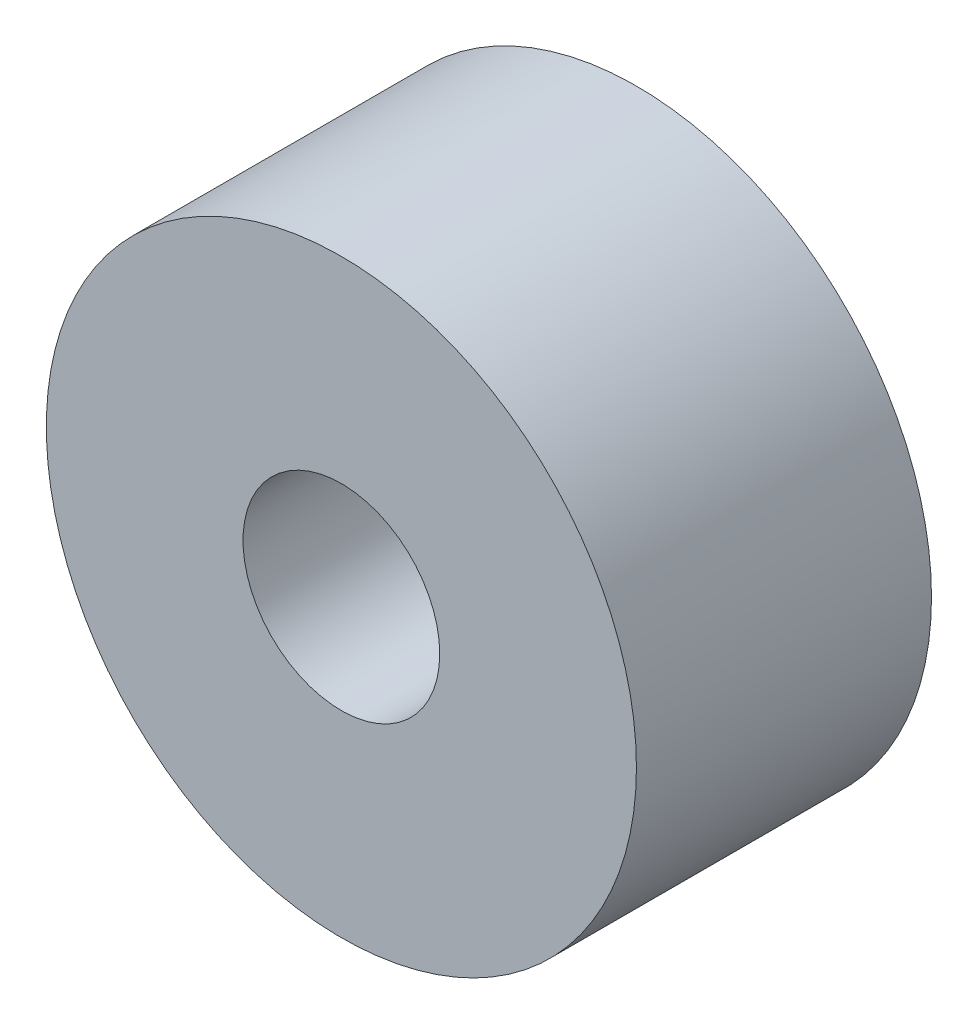
from build123d import *

# Parameters (mm, degrees)
SKETCH1_R           = 3
SKETCH1_R_2         = 1
BOSS_EXTRUDE1_DEPTH = 3


with BuildPart() as part:
    # Sketch1 → Boss-Extrude1 (new body)
    with BuildSketch(Plane.XY):
        Circle(SKETCH1_R)
        Circle(SKETCH1_R_2, mode=Mode.SUBTRACT)
    extrude(amount=BOSS_EXTRUDE1_DEPTH)


solid = part.part
